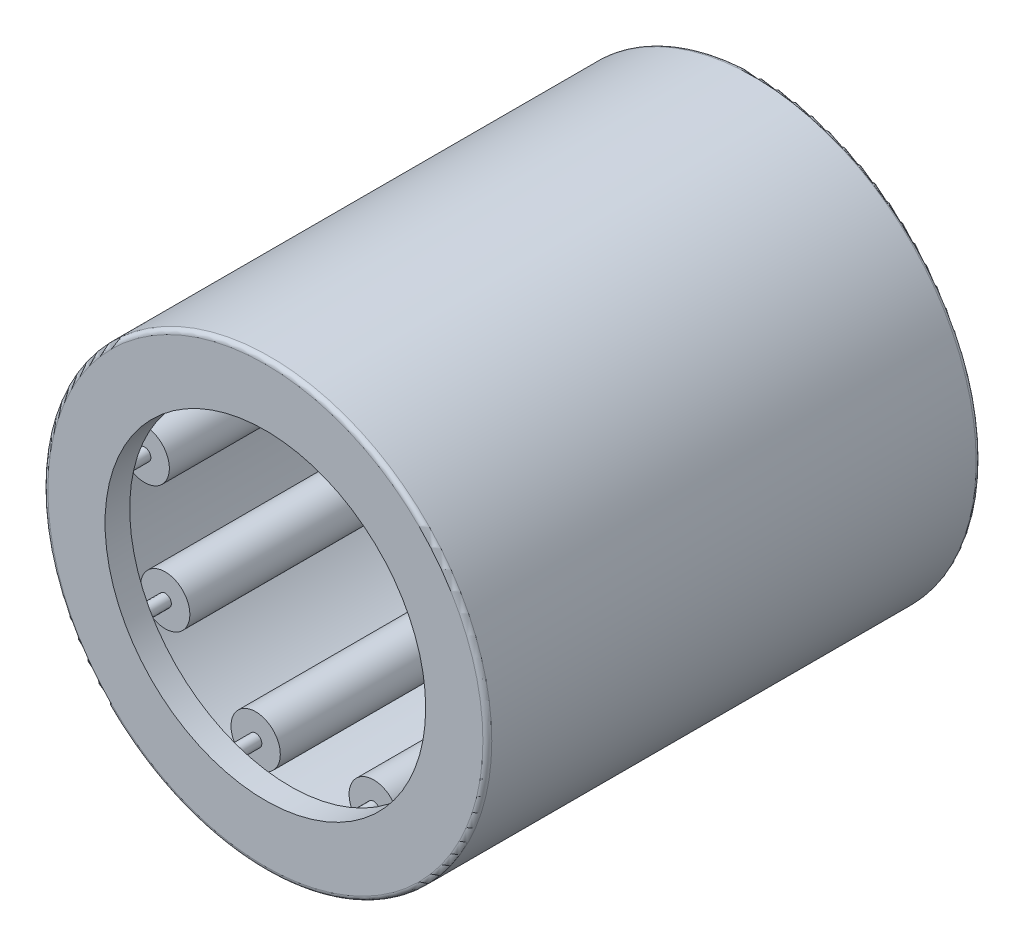
from build123d import *

# Parameters (mm, degrees)
SKETCH2_W         = 12.7
SKETCH2_H         = 0.5953125
SKETCH3_W         = 14.2875
SKETCH3_H         = 0.1984375
CIRPATTERN1_COUNT = 9
CIRPATTERN1_ANGLE = 320
FILLET1_R         = 0.142875


with BuildPart() as part:
    # Sketch1 → Revolve1 (revolve)
    with BuildSketch(Plane(origin=(0, 0, 0), x_dir=(0, 0, -1), z_dir=(1, 0, 0))):
        Polygon((-7.9375, 7.14375), (7.9375, 7.14375), (7.9375, 5.159375), (7.14375, 5.159375), (7.14375, 6.35), (-7.14375, 6.35), (-7.14375, 5.159375), (-7.9375, 5.159375), align=None)
    revolve(axis=Axis((0, 0, 7.9375), (0, 0, -1)))

    # Fillet1
    fillet1_edges = [part.edges().sort_by_distance(p)[0] for p in [
        (0, -7.14375, -7.9375),
        (0, -7.14375, 7.9375),
    ]]
    fillet(fillet1_edges, radius=FILLET1_R)


with BuildPart() as body_2:
    # Sketch2 → Revolve2 (revolve)
    with BuildSketch(Plane(origin=(0, 0, 0), x_dir=(0, 0, -1), z_dir=(1, 0, 0))):
        with Locations((0, 6.05234375)):
            Rectangle(SKETCH2_W, SKETCH2_H)
    revolve(axis=Axis((0, 5.55625, 6.35), (0, 0, -1)))


with BuildPart() as body_3:
    # Sketch3 → Revolve3 (revolve)
    with BuildSketch(Plane(origin=(0, 0, 0), x_dir=(0, 0, -1), z_dir=(1, 0, 0))):
        with Locations((0, 5.65546875)):
            Rectangle(SKETCH3_W, SKETCH3_H)
    revolve(axis=Axis((0, 5.55625, 7.14375), (0, 0, -1)))


with BuildPart() as cirpattern1_1:
    # CirPattern1: pattern copy
    add(body_2.part.rotate(Axis((0, 0, -7.9375), (0, 0, 1)), 1 * CIRPATTERN1_ANGLE / (CIRPATTERN1_COUNT - 1)))


with BuildPart() as cirpattern1_2:
    # CirPattern1: pattern copy
    add(body_2.part.rotate(Axis((0, 0, -7.9375), (0, 0, 1)), 2 * CIRPATTERN1_ANGLE / (CIRPATTERN1_COUNT - 1)))


with BuildPart() as cirpattern1_3:
    # CirPattern1: pattern copy
    add(body_2.part.rotate(Axis((0, 0, -7.9375), (0, 0, 1)), 3 * CIRPATTERN1_ANGLE / (CIRPATTERN1_COUNT - 1)))


with BuildPart() as cirpattern1_4:
    # CirPattern1: pattern copy
    add(body_2.part.rotate(Axis((0, 0, -7.9375), (0, 0, 1)), 4 * CIRPATTERN1_ANGLE / (CIRPATTERN1_COUNT - 1)))


with BuildPart() as cirpattern1_5:
    # CirPattern1: pattern copy
    add(body_2.part.rotate(Axis((0, 0, -7.9375), (0, 0, 1)), 5 * CIRPATTERN1_ANGLE / (CIRPATTERN1_COUNT - 1)))


with BuildPart() as cirpattern1_6:
    # CirPattern1: pattern copy
    add(body_2.part.rotate(Axis((0, 0, -7.9375), (0, 0, 1)), 6 * CIRPATTERN1_ANGLE / (CIRPATTERN1_COUNT - 1)))


with BuildPart() as cirpattern1_7:
    # CirPattern1: pattern copy
    add(body_2.part.rotate(Axis((0, 0, -7.9375), (0, 0, 1)), 7 * CIRPATTERN1_ANGLE / (CIRPATTERN1_COUNT - 1)))


with BuildPart() as cirpattern1_8:
    # CirPattern1: pattern copy
    add(body_2.part.rotate(Axis((0, 0, -7.9375), (0, 0, 1)), 8 * CIRPATTERN1_ANGLE / (CIRPATTERN1_COUNT - 1)))


with BuildPart() as cirpattern1_9:
    # CirPattern1: pattern copy
    add(body_3.part.rotate(Axis((0, 0, -7.9375), (0, 0, 1)), 1 * CIRPATTERN1_ANGLE / (CIRPATTERN1_COUNT - 1)))


with BuildPart() as cirpattern1_10:
    # CirPattern1: pattern copy
    add(body_3.part.rotate(Axis((0, 0, -7.9375), (0, 0, 1)), 2 * CIRPATTERN1_ANGLE / (CIRPATTERN1_COUNT - 1)))


with BuildPart() as cirpattern1_11:
    # CirPattern1: pattern copy
    add(body_3.part.rotate(Axis((0, 0, -7.9375), (0, 0, 1)), 3 * CIRPATTERN1_ANGLE / (CIRPATTERN1_COUNT - 1)))


with BuildPart() as cirpattern1_12:
    # CirPattern1: pattern copy
    add(body_3.part.rotate(Axis((0, 0, -7.9375), (0, 0, 1)), 4 * CIRPATTERN1_ANGLE / (CIRPATTERN1_COUNT - 1)))


with BuildPart() as cirpattern1_13:
    # CirPattern1: pattern copy
    add(body_3.part.rotate(Axis((0, 0, -7.9375), (0, 0, 1)), 5 * CIRPATTERN1_ANGLE / (CIRPATTERN1_COUNT - 1)))


with BuildPart() as cirpattern1_14:
    # CirPattern1: pattern copy
    add(body_3.part.rotate(Axis((0, 0, -7.9375), (0, 0, 1)), 6 * CIRPATTERN1_ANGLE / (CIRPATTERN1_COUNT - 1)))


with BuildPart() as cirpattern1_15:
    # CirPattern1: pattern copy
    add(body_3.part.rotate(Axis((0, 0, -7.9375), (0, 0, 1)), 7 * CIRPATTERN1_ANGLE / (CIRPATTERN1_COUNT - 1)))


with BuildPart() as cirpattern1_16:
    # CirPattern1: pattern copy
    add(body_3.part.rotate(Axis((0, 0, -7.9375), (0, 0, 1)), 8 * CIRPATTERN1_ANGLE / (CIRPATTERN1_COUNT - 1)))


solid = Compound([part.part, body_2.part, body_3.part, cirpattern1_1.part, cirpattern1_2.part, cirpattern1_3.part, cirpattern1_4.part, cirpattern1_5.part, cirpattern1_6.part, cirpattern1_7.part, cirpattern1_8.part, cirpattern1_9.part, cirpattern1_10.part, cirpattern1_11.part, cirpattern1_12.part, cirpattern1_13.part, cirpattern1_14.part, cirpattern1_15.part, cirpattern1_16.part])
